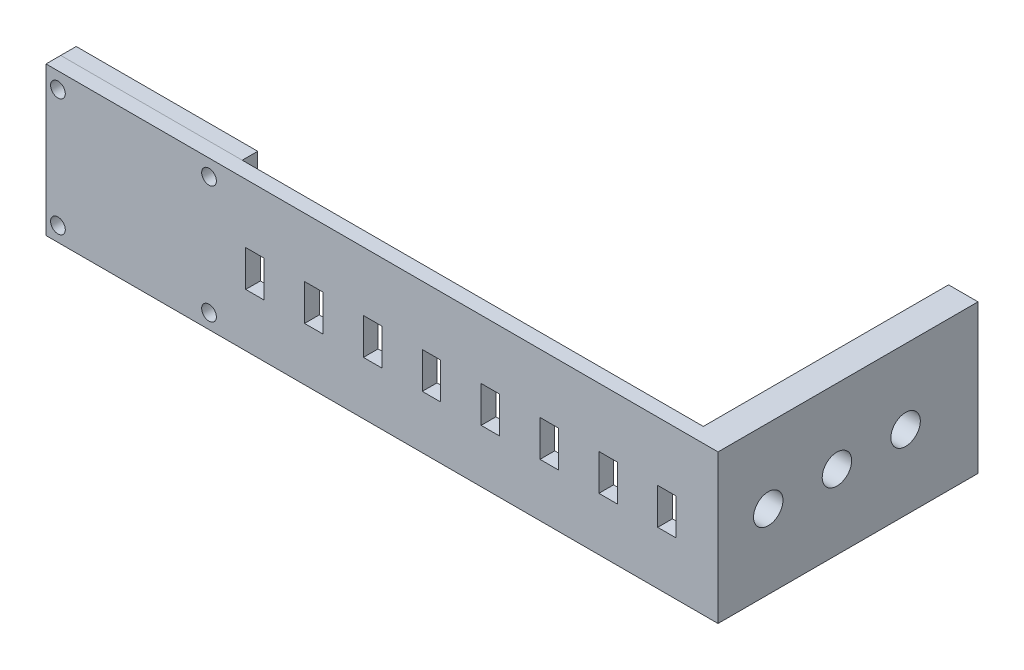
from build123d import *

# Parameters (mm, degrees)
BOSS_EXTRUDE1_DEPTH      = 1.58
BOSS_EXTRUDE1_2_DEPTH    = 1.58
BOSS_EXTRUDE2_START      = 1.5
SKETCH1_3_W              = 65.5
SKETCH1_3_H              = 15.15
SKETCH1_3_R              = 0.75
SKETCH1_3_W_2            = 1.878830328
SKETCH1_3_H_2            = 3.699830122
BOSS_EXTRUDE2_DEPTH      = 1.5
BOSS_EXTRUDE3_DEPTH      = 1.5
BOSS_EXTRUDE3_DEPTH_BACK = 25
SKETCH1_4_W              = 3
SKETCH1_4_H              = 15.15
SKETCH2_R                = 1.5
CUT_EXTRUDE1_DEPTH       = 4.5


with BuildPart() as part:
    # Sketch1 → Boss-Extrude1 (new body)
    with BuildSketch(Plane.XY.offset(1.58)):
        with BuildLine():
            Line((8.746817406, 1.826324453), (9.967181452, 1.826324453))
            Line((9.967181452, 1.826324453), (9.967181452, 3.826324453))
            Line((9.967181452, 3.826324453), (-3.278308886, 3.826324453))
            Line((-3.278308886, 3.826324453), (-7.473042484, 3.826324453))
            Line((-7.473042484, 3.826324453), (-8.532818548, 3.826324453))
            Line((-8.532818548, 3.826324453), (-8.532818548, 1.826324453))
            Line((-8.532818548, 1.826324453), (-7.97983251, 1.826324453))
            ThreePointArc((-7.97983251, 1.826324453), (-7.496793826, 2.904333285), (-6.566507552, 2.176324453))
            ThreePointArc((-6.566507552, 2.176324453), (-6.58849872, 1.996038178), (-6.653182594, 1.826324453))
            Line((-6.653182594, 1.826324453), (7.42016749, 1.826324453))
            ThreePointArc((7.42016749, 1.826324453), (7.903206174, 2.904333285), (8.833492448, 2.176324453))
            ThreePointArc((8.833492448, 2.176324453), (8.81150128, 1.996038178), (8.746817406, 1.826324453))
        make_face()
    extrude(amount=-BOSS_EXTRUDE1_DEPTH)


with BuildPart() as body_2:
    # Sketch1 → Boss-Extrude1 2 (new body)
    with BuildSketch(Plane.XY.offset(1.58)):
        with BuildLine():
            Line((-3.278308886, -11.323675547), (9.967181452, -11.323675547))
            Line((9.967181452, -11.323675547), (9.967181452, -9.323675547))
            Line((9.967181452, -9.323675547), (8.642509443, -9.323675547))
            ThreePointArc((8.642509443, -9.323675547), (8.784121717, -9.55605898), (8.833492448, -9.823675547))
            ThreePointArc((8.833492448, -9.823675547), (7.815875881, -10.524304817), (7.524475454, -9.323675547))
            Line((7.524475454, -9.323675547), (-6.757490557, -9.323675547))
            ThreePointArc((-6.757490557, -9.323675547), (-6.615878283, -9.55605898), (-6.566507552, -9.823675547))
            ThreePointArc((-6.566507552, -9.823675547), (-7.584124119, -10.524304817), (-7.875524546, -9.323675547))
            Line((-7.875524546, -9.323675547), (-8.532818548, -9.323675547))
            Line((-8.532818548, -9.323675547), (-8.532818548, -11.323675547))
            Line((-8.532818548, -11.323675547), (-7.473042484, -11.323675547))
            Line((-7.473042484, -11.323675547), (-3.278308886, -11.323675547))
        make_face()
    extrude(amount=-BOSS_EXTRUDE1_2_DEPTH)


with BuildPart() as body_3:
    # Sketch1<3> → Boss-Extrude2 (new body)
    with BuildSketch(Plane.XY.offset(1.58).offset(BOSS_EXTRUDE2_START)):
        with Locations((24.217181452, -3.748675547)):
            Rectangle(SKETCH1_3_W, SKETCH1_3_H)
        with Locations((8.083492448, 2.176324453)):
            Circle(SKETCH1_3_R, mode=Mode.SUBTRACT)
        with Locations((-7.316507552, 2.176324453)):
            Circle(SKETCH1_3_R, mode=Mode.SUBTRACT)
        with Locations((8.083492448, -9.823675547)):
            Circle(SKETCH1_3_R, mode=Mode.SUBTRACT)
        with Locations((-7.316507552, -9.823675547)):
            Circle(SKETCH1_3_R, mode=Mode.SUBTRACT)
        with Locations((54.762005624, -4.052899192)):
            Rectangle(SKETCH1_3_W_2, SKETCH1_3_H_2, mode=Mode.SUBTRACT)
        with Locations((12.762005624, -4.052899192)):
            Rectangle(SKETCH1_3_W_2, SKETCH1_3_H_2, mode=Mode.SUBTRACT)
        with Locations((18.762005624, -4.052899192)):
            Rectangle(SKETCH1_3_W_2, SKETCH1_3_H_2, mode=Mode.SUBTRACT)
        with Locations((24.762005624, -4.052899192)):
            Rectangle(SKETCH1_3_W_2, SKETCH1_3_H_2, mode=Mode.SUBTRACT)
        with Locations((30.762005624, -4.052899192)):
            Rectangle(SKETCH1_3_W_2, SKETCH1_3_H_2, mode=Mode.SUBTRACT)
        with Locations((36.762005624, -4.052899192)):
            Rectangle(SKETCH1_3_W_2, SKETCH1_3_H_2, mode=Mode.SUBTRACT)
        with Locations((42.762005624, -4.052899192)):
            Rectangle(SKETCH1_3_W_2, SKETCH1_3_H_2, mode=Mode.SUBTRACT)
        with Locations((48.762005624, -4.052899192)):
            Rectangle(SKETCH1_3_W_2, SKETCH1_3_H_2, mode=Mode.SUBTRACT)
    extrude(amount=-BOSS_EXTRUDE2_DEPTH)

    # Sketch1<4> → Boss-Extrude3 (add, two sides: drawn at the far end of the back side and taken through both)
    with BuildSketch(Plane.XY.offset(1.58).offset(-BOSS_EXTRUDE3_DEPTH_BACK)):
        with Locations((58.467181452, -3.748675547)):
            Rectangle(SKETCH1_4_W, SKETCH1_4_H)
    extrude(amount=BOSS_EXTRUDE3_DEPTH + BOSS_EXTRUDE3_DEPTH_BACK)

    # Sketch2 → Cut-Extrude1 (cut)
    with BuildSketch(Plane.ZY.offset(-56.967181452)):
        with Locations((-2.040233352, -3.748675547)):
            Circle(SKETCH2_R)
        with Locations((-9.040233352, -3.748675547)):
            Circle(SKETCH2_R)
        with Locations((-16.040233352, -3.748675547)):
            Circle(SKETCH2_R)
    extrude(amount=-CUT_EXTRUDE1_DEPTH, mode=Mode.SUBTRACT)


solid = Compound([part.part, body_2.part, body_3.part])
